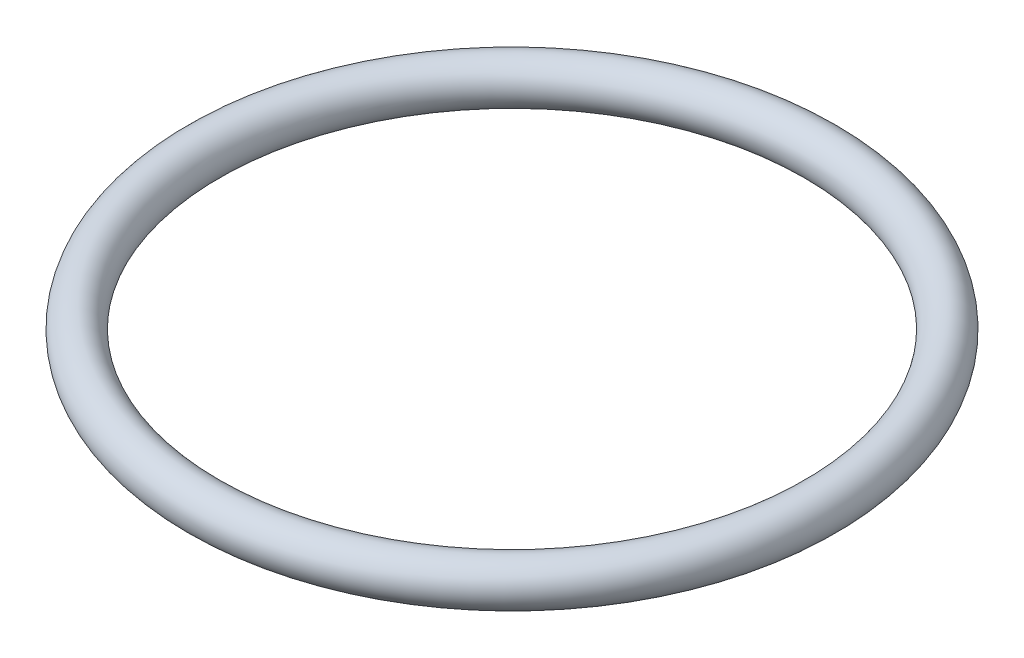
from build123d import *

# Parameters (mm, degrees)
SKETCH1_R = 0.9


with BuildPart() as part:
    # Sketch1 → Revolve1 (revolve)
    with BuildSketch(Plane(origin=(0, 0, 0), x_dir=(0, 0, -1), z_dir=(1, 0, 0)), mode=Mode.PRIVATE) as revolve1_sk:
        with Locations((-12.75, 0)):
            Circle(SKETCH1_R)
    revolve(revolve1_sk.sketch.rotate(Axis((0, -6.843396226, 0), (0, 1, 0)), 180), axis=Axis((0, -6.843396226, 0), (0, 1, 0)))


solid = part.part
